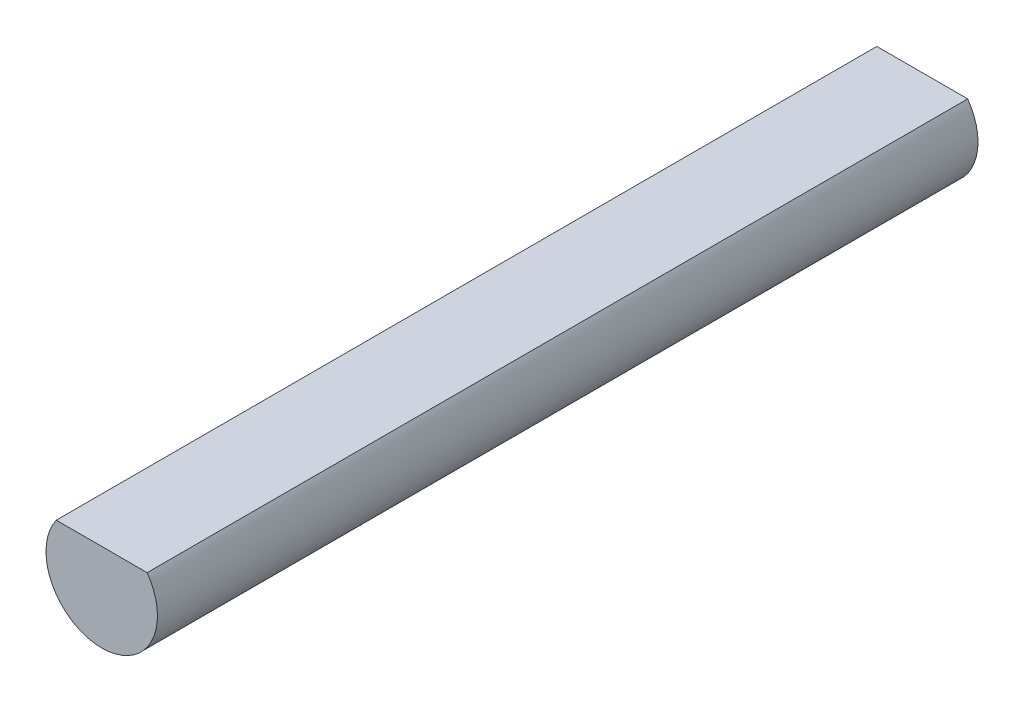
from build123d import *

# Parameters (mm, degrees)
SKETCH1_R           = 3.1369
BOSS_EXTRUDE1_DEPTH = 46.1899
CUT_EXTRUDE1_DEPTH  = 47.402447621


with BuildPart() as part:
    # Sketch1 → Boss-Extrude1 (new body)
    with BuildSketch(Plane.XY):
        Circle(SKETCH1_R)
    extrude(amount=-BOSS_EXTRUDE1_DEPTH)

    # Sketch2 → Cut-Extrude1 (cut, through all)
    with BuildSketch(Plane.XY):
        with BuildLine():
            Line((-2.557718202, 1.8161), (2.557718202, 1.8161))
            ThreePointArc((2.557718202, 1.8161), (0, 3.1369), (-2.557718202, 1.8161))
        make_face()
    extrude(amount=-CUT_EXTRUDE1_DEPTH, mode=Mode.SUBTRACT)


solid = part.part
